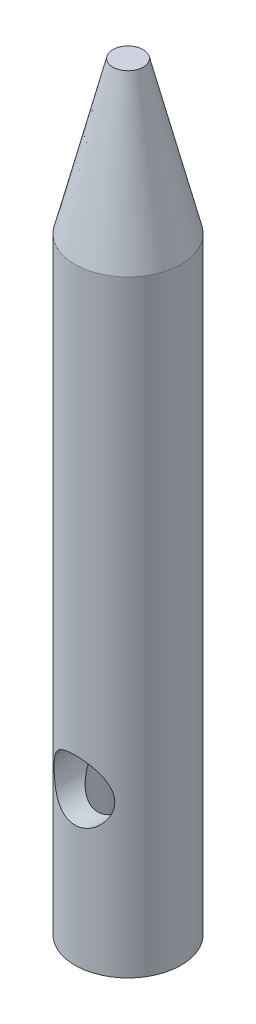
from build123d import *

# Parameters (mm, degrees)
SKETCH2_R          = 0.2
CUT_EXTRUDE1_DEPTH = 5


with BuildPart() as part:
    # Sketch1 → Revolve1 (revolve)
    with BuildSketch(Plane.XY, mode=Mode.PRIVATE) as revolve1_sk:
        Polygon((-0.2, 0), (-0.2, 2), (0, 2), (0, 5), (-0.1, 5), (-0.35, 4), (-0.35, 0), align=None)
    revolve(revolve1_sk.sketch.rotate(Axis((0, 0, 0), (0, 1, 0)), 270), axis=Axis((0, 0, 0), (0, 1, 0)))

    # Sketch2 → Cut-Extrude1 (cut, symmetric)
    with BuildSketch(Plane.XY):
        with Locations((0, 1)):
            Circle(SKETCH2_R)
    extrude(amount=CUT_EXTRUDE1_DEPTH, both=True, mode=Mode.SUBTRACT)


solid = part.part
